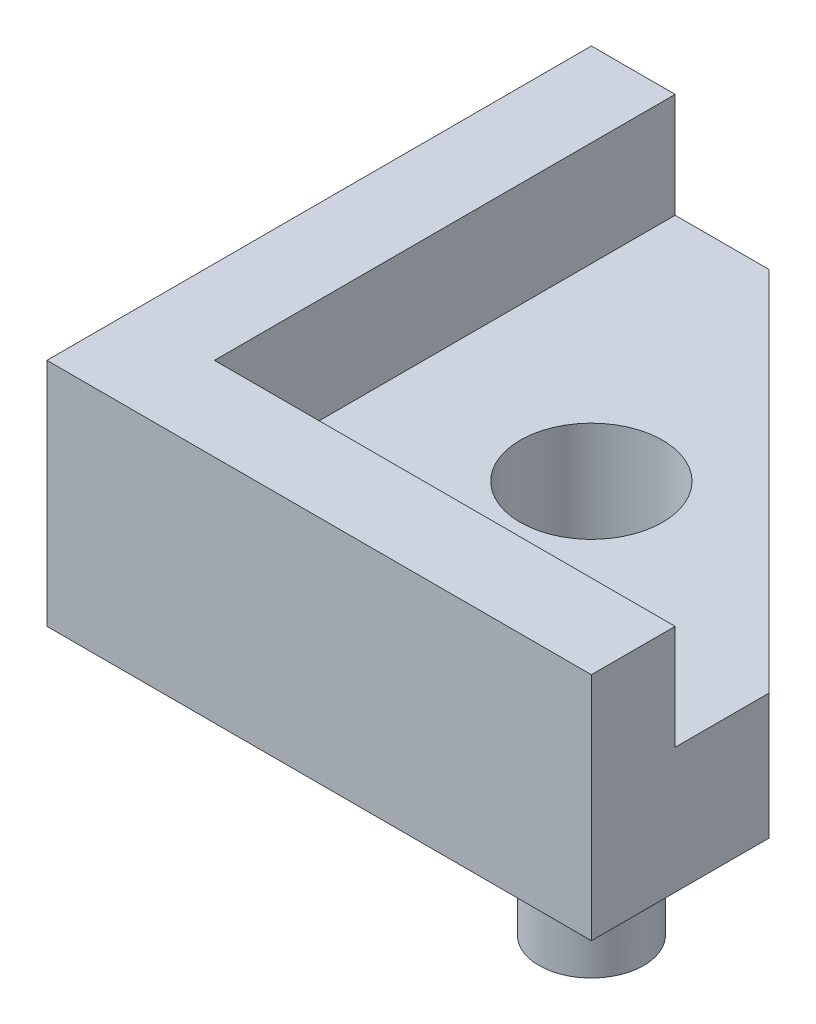
from build123d import *

# Parameters (mm, degrees)
BOSS_EXTRUDE2_DEPTH = 3
SKETCH4_R           = 1.25
BOSS_EXTRUDE3_DEPTH = 2.5
BOSS_EXTRUDE4_DEPTH = 2.5
CUT_EXTRUDE1_REACH  = 17.835
SKETCH6_R           = 1.7


with BuildPart() as part:
    # Sketch3 → Boss-Extrude2 (new body)
    with BuildSketch(Plane(origin=(0, 0, 0), x_dir=(1, 0, 0), z_dir=(0, 1, 0))):
        Polygon((-2.5, 10.5), (-2.5, -2.5), (10.5, -2.5), (10.5, 1.742640687), (1.742640687, 10.5), align=None)
    extrude(amount=-BOSS_EXTRUDE2_DEPTH)

    # Sketch4 → Boss-Extrude3 (add)
    with BuildSketch(Plane.XZ.offset(3)):
        with Locations(Location((7.889087297, -0.110912703, 0), (0, 0, 90))):
            Circle(SKETCH4_R)
        with Locations(Location((0.110912703, -7.889087297, 0), (0, 0, 90))):
            Circle(SKETCH4_R)
    extrude(amount=BOSS_EXTRUDE3_DEPTH)

    # Sketch5 → Boss-Extrude4 (add)
    with BuildSketch(Plane(origin=(0, 0, 0), x_dir=(1, 0, 0), z_dir=(0, 1, 0))):
        Polygon((-2.5, 10.5), (-2.5, -2.5), (10.5, -2.5), (10.5, -0.5), (-0.5, -0.5), (-0.5, 10.5), align=None)
    extrude(amount=BOSS_EXTRUDE4_DEPTH)

    # Sketch6 → Cut-Extrude1 (cut, up to next)
    with BuildSketch(Plane(origin=(0, 0, 0), x_dir=(1, 0, 0), z_dir=(0, 1, 0)), mode=Mode.PRIVATE) as cut_extrude1_sk1:
        with Locations(Location((4, 4, 0), (0, 0, 270))):
            Circle(SKETCH6_R)
    cut_extrude1_tool1 = extrude(cut_extrude1_sk1.sketch, amount=-CUT_EXTRUDE1_REACH, mode=Mode.PRIVATE) & part.part
    add(cut_extrude1_tool1.solids().sort_by_distance((4, 0, -4))[0], mode=Mode.SUBTRACT)


solid = part.part
